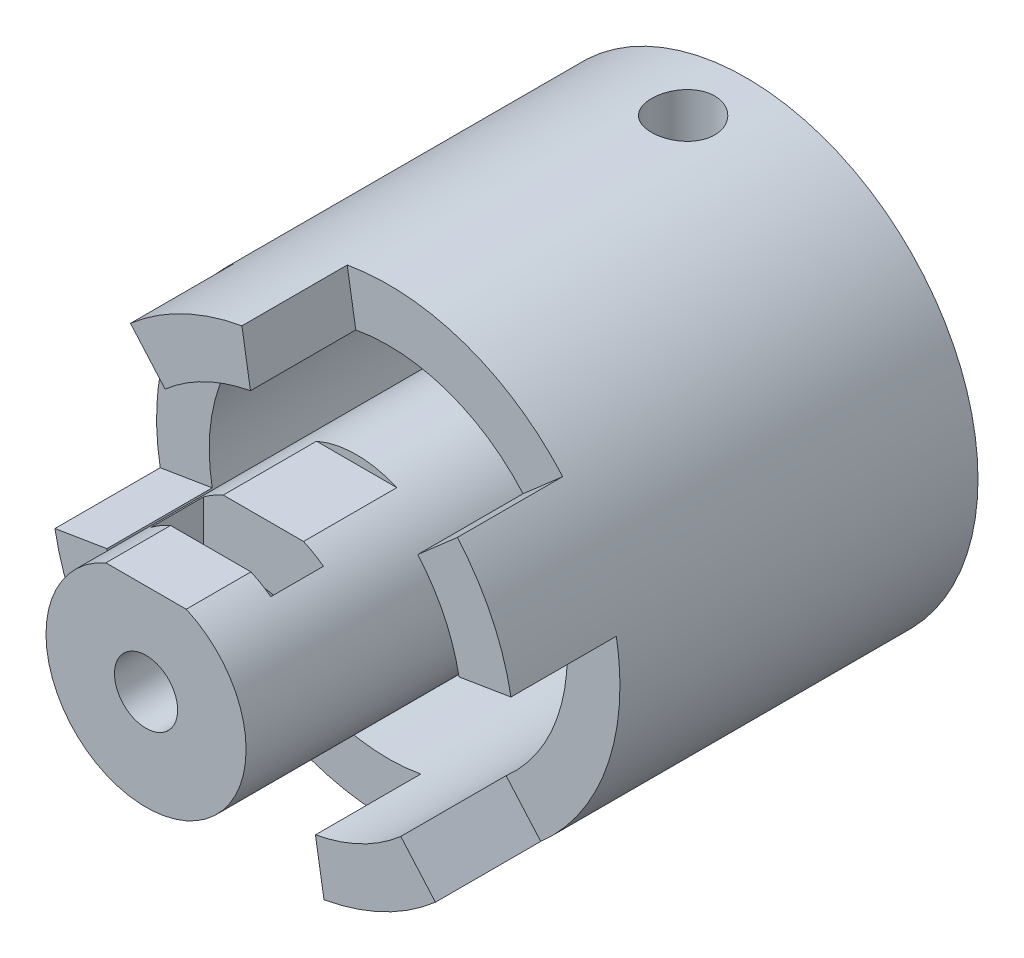
from build123d import *
from build123d.topology import SkipClean

# Parameters (mm, degrees)
BOSS_EXTRUDE2_DEPTH = 5
CIRPATTERN1_COUNT   = 4
SKETCH5_R           = 1.5
CUT_EXTRUDE1_DEPTH  = 10
CUT_EXTRUDE2_DEPTH  = 10
SKETCH8_W           = 5.65
SKETCH8_H           = 2.5
CUT_EXTRUDE3_DEPTH  = 6.5
SKETCH10_R          = 1.5
CUT_EXTRUDE5_DEPTH  = 10
CUT_EXTRUDE6_START  = -10
CUT_EXTRUDE6_DEPTH  = 10
SKETCH13_W          = 5.7
SKETCH13_H          = 2.5
CUT_EXTRUDE7_DEPTH  = 7.5


with BuildPart() as part:
    # Sketch3 → Revolve1 (revolve)
    with BuildSketch(Plane(origin=(0, 0, 0), x_dir=(0, 0, -1), z_dir=(1, 0, 0)), mode=Mode.PRIVATE) as revolve1_sk:
        Polygon((-7.337359925, 0), (14.162640075, 0), (14.162640075, -3.75), (4.162640075, -3.75), (4.162640075, -6.25), (16.162640075, -6.25), (21.162640075, -6.25), (21.162640075, -3.047373414), (21.162640075, 4.75), (19.162640075, 4.75), (-7.337359925, 4.75), align=None)
    revolve(revolve1_sk.sketch.rotate(Axis((0, 4.75, 26.894611834), (0, 0, -1)), 270), axis=Axis((0, 4.75, 26.894611834), (0, 0, -1)))

    # Sketch4 → Boss-Extrude2 (add)
    with SkipClean():  # the faces are left unmerged after this step: merging them gives an invalid solid
        with BuildSketch(Plane.XY.offset(-4.162640075)):
            with BuildLine():
                Line((-1.948133817, 15.576115399), (-1.542950524, 13.108786017))
                ThreePointArc((-1.542950524, 13.108786017), (-3.700532064, 12.402193309), (-5.594111688, 11.149680807))
                Line((-5.594111688, 11.149680807), (-7.239438655, 13.031939867))
                ThreePointArc((-7.239438655, 13.031939867), (-4.766663326, 14.663572552), (-1.948133817, 15.576115399))
            make_face()
        boss_extrude2 = extrude(amount=BOSS_EXTRUDE2_DEPTH)

    # CirPattern1: Boss-Extrude2 ×4 about axis
    with SkipClean():  # the faces are left unmerged after this step: merging them gives an invalid solid
        cirpattern1_axis = Axis((0, 4.75, 0), (0, 0, 1))
        for i in range(1, CIRPATTERN1_COUNT):
            add(boss_extrude2.rotate(cirpattern1_axis, i * 360 / CIRPATTERN1_COUNT))

    # Sketch5 → Cut-Extrude1 (cut)
    with SkipClean():  # the faces are left unmerged after this step: merging them gives an invalid solid
        with BuildSketch(Plane.XY.offset(7.337359925)):
            with Locations((0, 4.75)):
                Circle(SKETCH5_R)
        extrude(amount=-CUT_EXTRUDE1_DEPTH, mode=Mode.SUBTRACT)

    # Sketch7 → Cut-Extrude2 (cut)
    with SkipClean():  # the faces are left unmerged after this step: merging them gives an invalid solid
        with BuildSketch(Plane(origin=(0, 0, -21.162640075), x_dir=(-1, 0, 0), z_dir=(0, 0, -1))):
            with BuildLine():
                Line((-1.445, 6.273802809), (1.445, 6.273802809))
                ThreePointArc((1.445, 6.273802809), (0, 2.65), (-1.445, 6.273802809))
            make_face()
        extrude(amount=-CUT_EXTRUDE2_DEPTH, mode=Mode.SUBTRACT)

    # Sketch8 → Cut-Extrude3 (cut)
    with SkipClean():  # the faces are left unmerged after this step: merging them gives an invalid solid
        with BuildSketch(Plane(origin=(0, 0, -21.162640075), x_dir=(-1, 0, 0), z_dir=(0, 0, -1))):
            with Locations((0, 8.523802809)):
                Rectangle(SKETCH8_W, SKETCH8_H)
        extrude(amount=-CUT_EXTRUDE3_DEPTH, mode=Mode.SUBTRACT)

    # Sketch10 → Cut-Extrude5 (cut)
    with SkipClean():  # the faces are left unmerged after this step: merging them gives an invalid solid
        with BuildSketch(Plane.XZ.offset(-6.273802809)):
            with Locations(Location((0, -18.162640075, 0), (0, 0, 270))):
                Circle(SKETCH10_R)
        extrude(amount=-CUT_EXTRUDE5_DEPTH, mode=Mode.SUBTRACT)

    # Sketch12 → Cut-Extrude6 (cut)
    with SkipClean():  # the faces are left unmerged after this step: merging them gives an invalid solid
        with BuildSketch(Plane.XY.offset(7.337359925).offset(CUT_EXTRUDE6_START)):
            with BuildLine():
                Line((-1.907535842, 9.100150229), (1.907535842, 9.100150229))
                ThreePointArc((1.907535842, 9.100150229), (0, 9.5), (-1.907535842, 9.100150229))
            make_face()
        extrude(amount=CUT_EXTRUDE6_DEPTH, mode=Mode.SUBTRACT)

    # Sketch13 → Cut-Extrude7 (cut)
    with SkipClean():  # the faces are left unmerged after this step: merging them gives an invalid solid
        with BuildSketch(Plane(origin=(0, 9.100150229, 0), x_dir=(1, 0, 0), z_dir=(0, 1, 0))):
            with Locations((0, -3.015381777)):
                Rectangle(SKETCH13_W, SKETCH13_H)
        extrude(amount=-CUT_EXTRUDE7_DEPTH, mode=Mode.SUBTRACT)


solid = part.part
